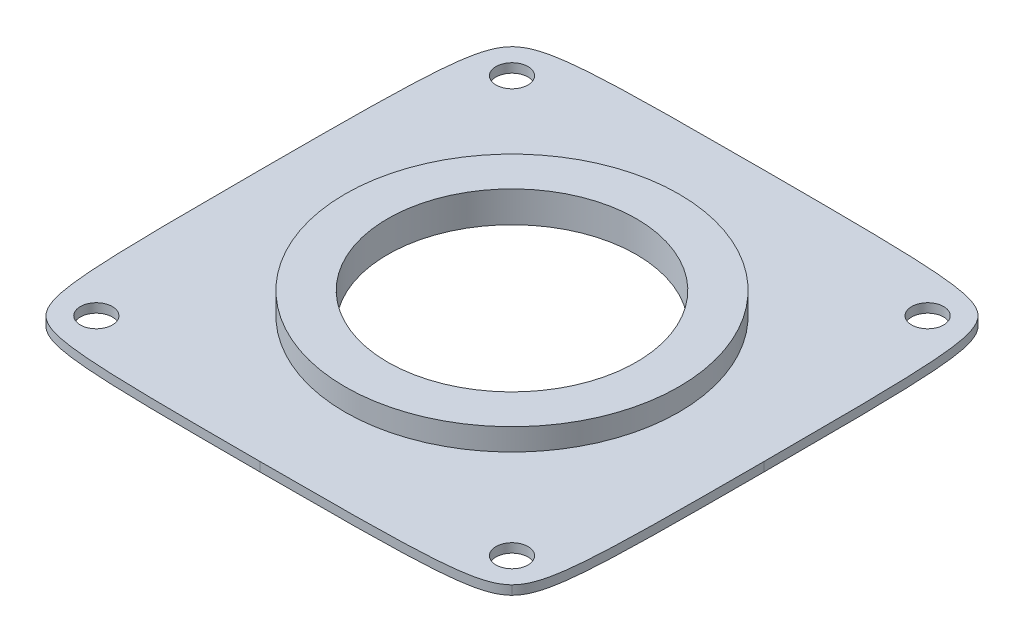
from build123d import *

# Parameters (mm, degrees)
SKETCH1_R           = 2.25
SKETCH1_R_2         = 17.5
BOSS_EXTRUDE1_DEPTH = 1.28
SKETCH2_R           = 23.5
SKETCH2_R_2         = 17.5
BOSS_EXTRUDE2_DEPTH = 3.09


with BuildPart() as part:
    # Sketch1 → Boss-Extrude1 (new body)
    with BuildSketch(Plane(origin=(0, 0, 0), x_dir=(1, 0, 0), z_dir=(0, 1, 0))):
        with BuildLine():
            add(Edge.make_bspline(
                [(0, 35.5), (-24.068741191, 35.5), (-30.297901131, 35.2922383), (-32.795069715, 32.795069715)],
                knots=[0, 0, 0, 0, 1, 1, 1, 1], degree=3))
            add(Edge.make_bspline(
                [(-35.5, 0), (-35.5, 24.068741191), (-35.2922383, 30.297901131), (-32.795069715, 32.795069715)],
                knots=[0, 0, 0, 0, 1, 1, 1, 1], degree=3))
            add(Edge.make_bspline(
                [(-35.5, 0), (-35.5, -24.068741191), (-35.2922383, -30.297901131), (-32.795069715, -32.795069715)],
                knots=[0, 0, 0, 0, 1, 1, 1, 1], degree=3))
            add(Edge.make_bspline(
                [(0, -35.5), (-24.068741191, -35.5), (-30.297901131, -35.2922383), (-32.795069715, -32.795069715)],
                knots=[0, 0, 0, 0, 1, 1, 1, 1], degree=3))
            add(Edge.make_bspline(
                [(0, -35.5), (24.068741191, -35.5), (30.297901131, -35.2922383), (32.795069715, -32.795069715)],
                knots=[0, 0, 0, 0, 1, 1, 1, 1], degree=3))
            add(Edge.make_bspline(
                [(35.5, 0), (35.5, -24.068741191), (35.2922383, -30.297901131), (32.795069715, -32.795069715)],
                knots=[0, 0, 0, 0, 1, 1, 1, 1], degree=3))
            add(Edge.make_bspline(
                [(35.5, 0), (35.5, 24.068741191), (35.2922383, 30.297901131), (32.795069715, 32.795069715)],
                knots=[0, 0, 0, 0, 1, 1, 1, 1], degree=3))
            add(Edge.make_bspline(
                [(0, 35.5), (24.068741191, 35.5), (30.297901131, 35.2922383), (32.795069715, 32.795069715)],
                knots=[0, 0, 0, 0, 1, 1, 1, 1], degree=3))
        make_face()
        with Locations(Location((29.253007538, 29.253007538, 0), (0, 0, 90))):
            Circle(SKETCH1_R, mode=Mode.SUBTRACT)
        with Locations(Location((29.253007538, -29.253007538, 0), (0, 0, 90))):
            Circle(SKETCH1_R, mode=Mode.SUBTRACT)
        with Locations(Location((-29.253007538, -29.253007538, 0), (0, 0, 90))):
            Circle(SKETCH1_R, mode=Mode.SUBTRACT)
        with Locations(Location((-29.253007538, 29.253007538, 0), (0, 0, 90))):
            Circle(SKETCH1_R, mode=Mode.SUBTRACT)
        with Locations(Location((0, 0, 0), (0, 0, 90))):
            Circle(SKETCH1_R_2, mode=Mode.SUBTRACT)
    extrude(amount=BOSS_EXTRUDE1_DEPTH)

    # Sketch2 → Boss-Extrude2 (add)
    with BuildSketch(Plane(origin=(0, 1.28, 0), x_dir=(1, 0, 0), z_dir=(0, 1, 0))):
        with Locations(Location((0, 0, 0), (0, 0, 270))):
            Circle(SKETCH2_R)
        with Locations(Location((0, 0, 0), (0, 0, 90))):
            Circle(SKETCH2_R_2, mode=Mode.SUBTRACT)
    extrude(amount=BOSS_EXTRUDE2_DEPTH)


solid = part.part
